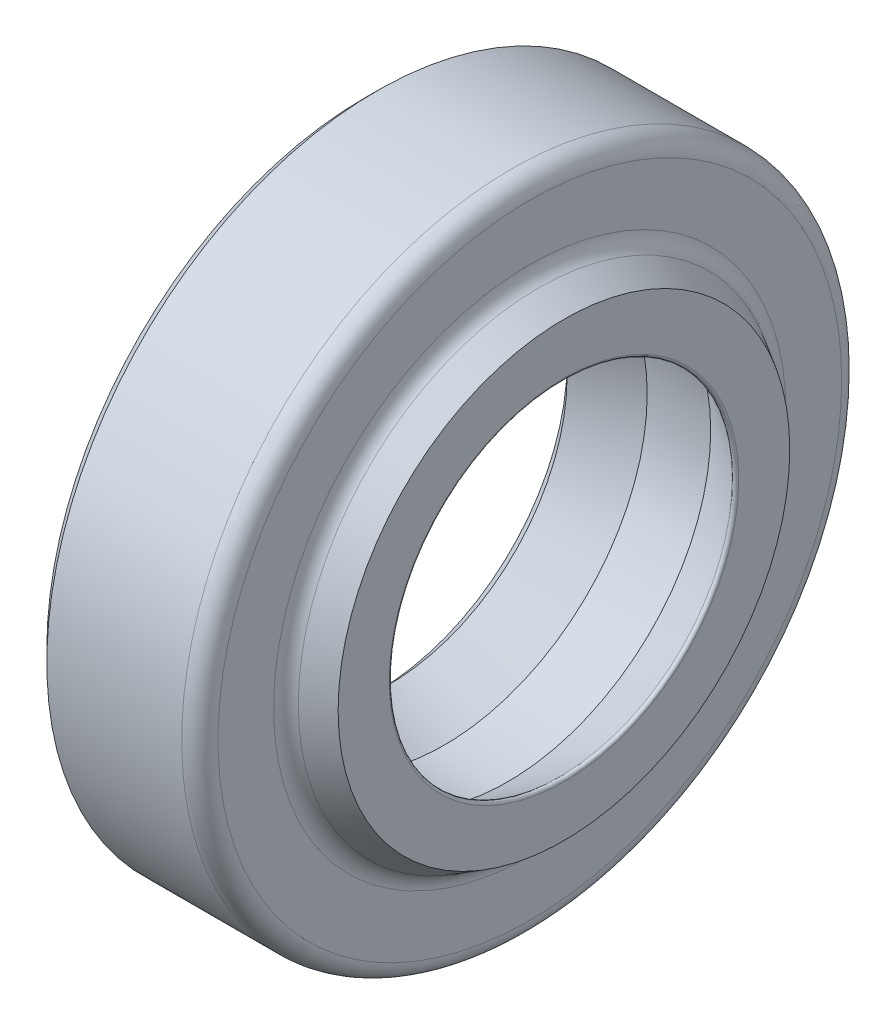
from build123d import *


with BuildPart() as part:
    # Sketch1 → Revolve1 (revolve)
    with BuildSketch(Plane.XY, mode=Mode.PRIVATE) as revolve1_sk:
        with BuildLine():
            Line((-2.3453217, 5.55498), (-0.63265685, 6.35))
            Line((-0.63265685, 6.35), (1.353716934, 6.35))
            Line((1.353716934, 6.35), (2.983459057, 5.396470607))
            ThreePointArc((2.983459057, 5.396470607), (3.06874832, 5.396101014), (3.1115, 5.4699027))
            Line((3.1115, 5.4699027), (3.1115, 7.065518))
            Line((3.1115, 7.065518), (2.325457711, 7.525415561))
            ThreePointArc((2.325457711, 7.525415561), (2.119870759, 7.73279205), (2.0447, 8.01496285))
            Line((2.0447, 8.01496285), (2.0447, 9.757918))
            ThreePointArc((2.0447, 9.757918), (1.878576238, 10.158976238), (1.477518, 10.3251))
            Line((1.477518, 10.3251), (-2.7428317, 10.3251))
            Line((-2.7428317, 10.3251), (-3.1115, 9.9564317))
            Line((-3.1115, 9.9564317), (-3.1115, 9.013317))
            Line((-3.1115, 9.013317), (-0.866916035, 8.616817304))
            ThreePointArc((-0.866916035, 8.616817304), (-0.63265685, 8.33755), (-0.866916035, 8.058282696))
            Line((-0.866916035, 8.058282696), (-2.7428317, 7.72690726))
            Line((-2.7428317, 7.72690726), (-2.7428317, 5.95249))
            Line((-2.7428317, 5.95249), (-2.3453217, 5.55498))
        make_face()
    revolve(revolve1_sk.sketch.rotate(Axis((-3.1115, 0, 0), (1, 0, 0)), 270), axis=Axis((-3.1115, 0, 0), (1, 0, 0)))


solid = part.part
